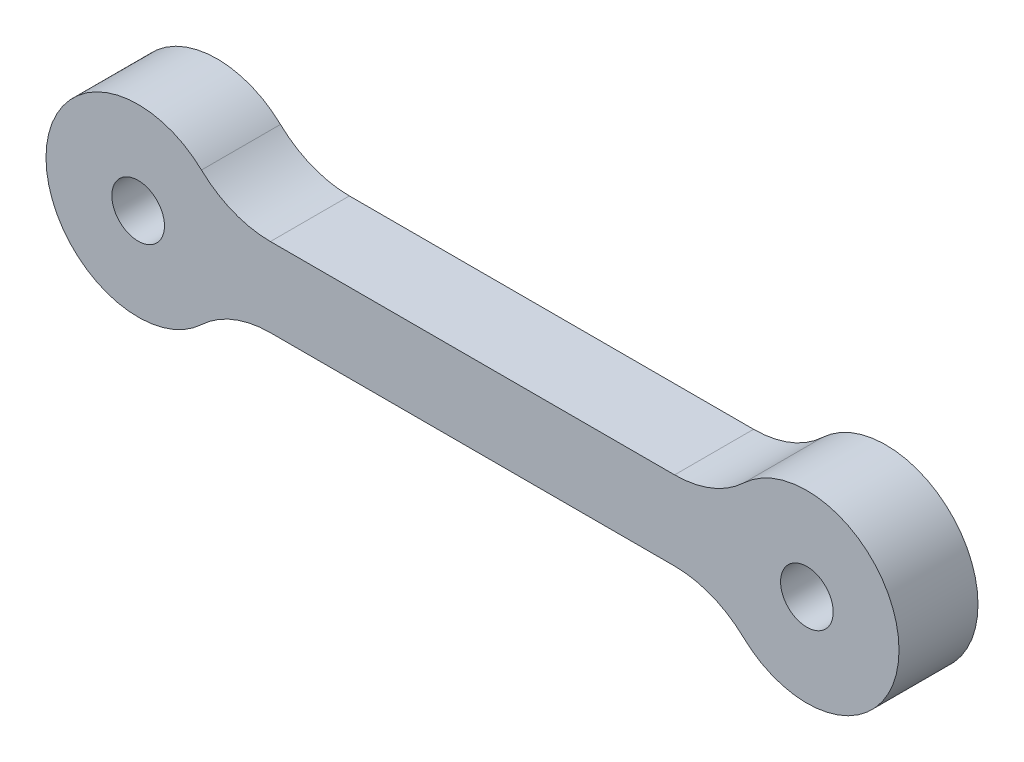
from build123d import *

# Parameters (mm, degrees)
SKETCH_1_R      = 1
EXTRUDE_1_DEPTH = 3
FILLET_1_R      = 3.81


with BuildPart() as part:
    # 스케치1 → 보스-돌출1 (new body)
    with BuildSketch(Plane.XY):
        with BuildLine():
            Line((-9.53772234, -1.5), (9.53772234, -1.5))
            ThreePointArc((9.53772234, -1.5), (16.2, 0), (9.53772234, 1.5))
            Line((9.53772234, 1.5), (-9.53772234, 1.5))
            ThreePointArc((-9.53772234, 1.5), (-16.2, 0), (-9.53772234, -1.5))
        make_face()
        with Locations((-12.7, 0)):
            Circle(SKETCH_1_R, mode=Mode.SUBTRACT)
        with Locations((12.7, 0)):
            Circle(SKETCH_1_R, mode=Mode.SUBTRACT)
    extrude(amount=EXTRUDE_1_DEPTH)

    # 필렛1
    fillet_1_edges = [part.edges().sort_by_distance(p)[0] for p in [
        (9.53772234, -1.5, 1.5),
        (-9.53772234, -1.5, 1.5),
        (-9.53772234, 1.5, 1.5),
        (9.53772234, 1.5, 1.5),
    ]]
    fillet(fillet_1_edges, radius=FILLET_1_R)


solid = part.part
